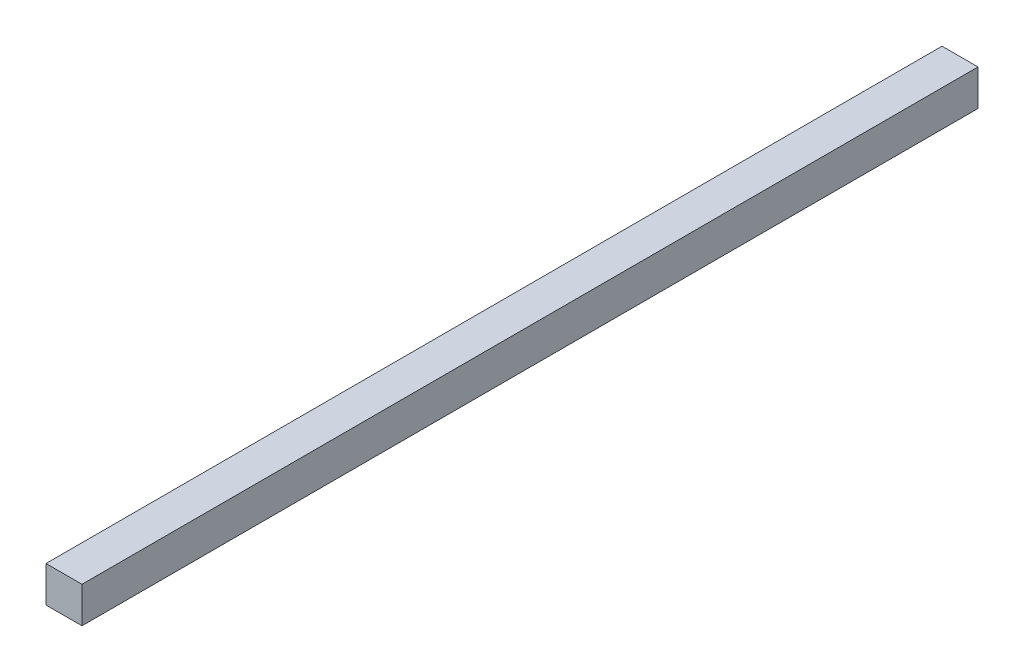
from build123d import *

# Parameters (mm, degrees)
SKETCH1_W           = 25.4
SKETCH1_H           = 25.4
BOSS_EXTRUDE1_DEPTH = 632.46


with BuildPart() as part:
    # Sketch1 → Boss-Extrude1 (new body)
    with BuildSketch(Plane.XY):
        Rectangle(SKETCH1_W, SKETCH1_H)
    extrude(amount=BOSS_EXTRUDE1_DEPTH)


solid = part.part
